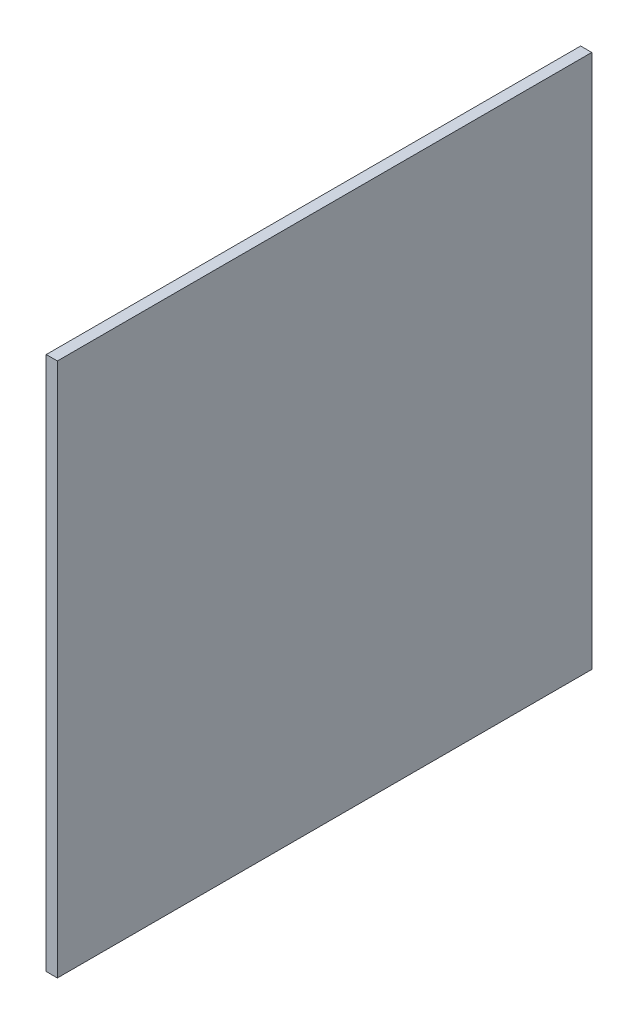
from build123d import *

# Parameters (mm, degrees)
SKETCH1_W           = 304.8
SKETCH1_H           = 304.8
BOSS_EXTRUDE1_DEPTH = 6.35


with BuildPart() as part:
    # Sketch1 → Boss-Extrude1 (new body)
    with BuildSketch(Plane(origin=(0, 0, 0), x_dir=(0, 0, -1), z_dir=(1, 0, 0))):
        Rectangle(SKETCH1_W, SKETCH1_H)
    extrude(amount=BOSS_EXTRUDE1_DEPTH)


solid = part.part
